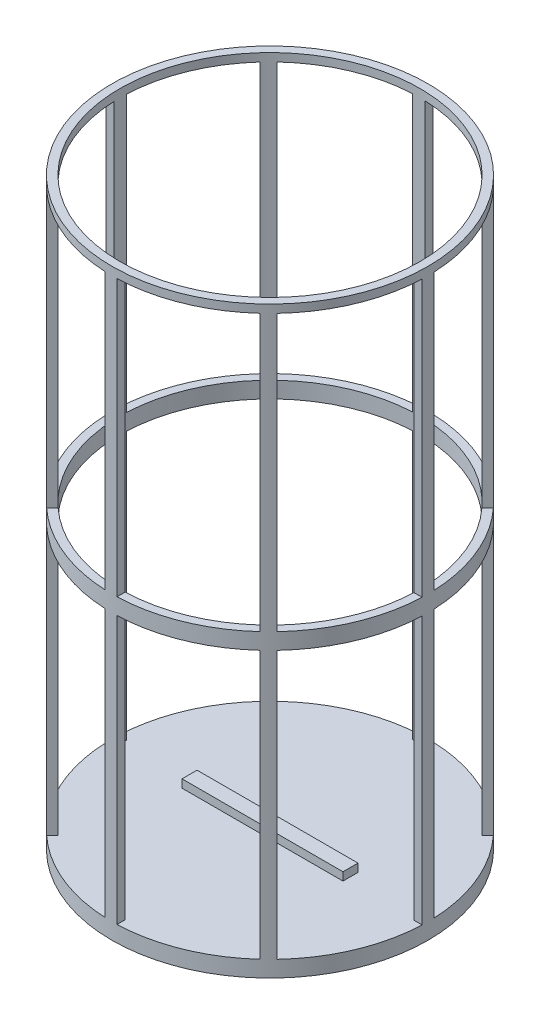
from build123d import *

# Parameters (mm, degrees)
SKETCH1_R               = 49.53
SKETCH1_R_2             = 46.99
BOSS_EXTRUDE1_DEPTH     = 182.88
CUT_EXTRUDE1_DEPTH      = 177.8
SKETCH3_R               = 49.53
SKETCH3_R_2             = 46.99
BOSS_EXTRUDE2_DEPTH     = 2.54
SKETCH4_R               = 49.53
SKETCH4_R_2             = 46.99
BOSS_EXTRUDE3_DEPTH     = 2.54
BOSS_EXTRUDE4_START     = -5.08
SKETCH5_R               = 49.53
BOSS_EXTRUDE4_DEPTH     = 5.08
SKETCH6_W               = 50.419
SKETCH6_H               = 4.699
BOSS_EXTRUDE5_DEPTH     = 2.54
SKETCH7_R               = 0.8255
BOSS_EXTRUDE6_DEPTH     = 2.54
CIRPATTERN2_COUNT       = 8
CUT_EXTRUDE2_DEPTH      = 199.209531052
CUT_EXTRUDE2_DEPTH_BACK = 199.209531052
SKETCH8_W               = 111.115562831
SKETCH8_H               = 193.581618433


with BuildPart() as part:
    # Sketch1 → Boss-Extrude1 (new, symmetric)
    with BuildSketch(Plane(origin=(0, 0, 0), x_dir=(1, 0, 0), z_dir=(0, 1, 0))):
        with Locations(Location((0, 0, 0), (0, 0, 270))):
            Circle(SKETCH1_R)
        with Locations(Location((0, 0, 0), (0, 0, 270))):
            Circle(SKETCH1_R_2, mode=Mode.SUBTRACT)
    extrude(amount=BOSS_EXTRUDE1_DEPTH, both=True)

    # Sketch2 → Cut-Extrude1 (cut, symmetric)
    with BuildSketch(Plane(origin=(0, 0, 0), x_dir=(1, 0, 0), z_dir=(0, 1, 0))):
        with BuildLine():
            Line((34.339077963, -32.07628134), (36.13611782, -33.873321197))
            ThreePointArc((36.13611782, -33.873321197), (45.710930003, -19.071753413), (49.49527883, -1.854258207))
            Line((49.49527883, -1.854258207), (46.953400585, -1.854258207))
            ThreePointArc((46.953400585, -1.854258207), (43.364264524, -18.099742051), (34.339077963, -32.07628134))
        make_face()
        with BuildLine():
            ThreePointArc((1.584890151, -49.504636381), (18.664975227, -45.878530924), (33.425440685, -36.550797734))
            Line((33.425440685, -36.550797734), (31.627502039, -34.752859088))
            ThreePointArc((31.627502039, -34.752859088), (17.692915235, -43.531837205), (1.584890151, -46.963264614))
            Line((1.584890151, -46.963264614), (1.584890151, -49.504636381))
        make_face()
        with BuildLine():
            ThreePointArc((-33.543952964, -36.442065248), (-19.03558139, -45.726005086), (-2.225109849, -49.479993797))
            Line((-2.225109849, -49.479993797), (-2.225109849, -46.937287801))
            ThreePointArc((-2.225109849, -46.937287801), (-18.063572268, -43.379343666), (-31.746279167, -34.644391451))
            Line((-31.746279167, -34.644391451), (-33.543952964, -36.442065248))
        make_face()
        with BuildLine():
            Line((46.949282998, 1.955741793), (49.491372723, 1.955741793))
            ThreePointArc((49.491372723, 1.955741793), (45.777644234, 18.911059948), (36.442065248, 33.543952964))
            Line((36.442065248, 33.543952964), (34.644391451, 31.746279167))
            ThreePointArc((34.644391451, 31.746279167), (43.430990742, 17.93903964), (46.949282998, 1.955741793))
        make_face()
        with BuildLine():
            ThreePointArc((-49.49527883, -1.854258207), (-45.741824116, -18.997537381), (-36.245883162, -33.755841773))
            Line((-36.245883162, -33.755841773), (-34.448634556, -31.958593167))
            ThreePointArc((-34.448634556, -31.958593167), (-43.39516767, -18.025524205), (-46.953400585, -1.854258207))
            Line((-46.953400585, -1.854258207), (-49.49527883, -1.854258207))
        make_face()
        with BuildLine():
            Line((31.958593167, 34.448634556), (33.755841773, 36.245883162))
            ThreePointArc((33.755841773, 36.245883162), (18.873008967, 45.79334485), (1.584890151, 49.504636381))
            Line((1.584890151, 49.504636381), (1.584890151, 46.963264614))
            ThreePointArc((1.584890151, 46.963264614), (17.900986276, 43.446689061), (31.958593167, 34.448634556))
        make_face()
        with BuildLine():
            ThreePointArc((-36.550797734, 33.425440685), (-45.80828813, 18.836709868), (-49.491372723, 1.955741793))
            Line((-49.491372723, 1.955741793), (-46.949282998, 1.955741793))
            ThreePointArc((-46.949282998, 1.955741793), (-43.461630715, 17.864678995), (-34.752859088, 31.627502039))
            Line((-34.752859088, 31.627502039), (-36.550797734, 33.425440685))
        make_face()
        with BuildLine():
            Line((-2.225109849, 46.937287801), (-2.225109849, 49.479993797))
            ThreePointArc((-2.225109849, 49.479993797), (-19.242893169, 45.63914945), (-33.873321197, 36.13611782))
            Line((-33.873321197, 36.13611782), (-32.07628134, 34.339077963))
            ThreePointArc((-32.07628134, 34.339077963), (-18.270880717, 43.292436035), (-2.225109849, 46.937287801))
        make_face()
    extrude(amount=CUT_EXTRUDE1_DEPTH, both=True, mode=Mode.SUBTRACT)

    # Sketch3 → Boss-Extrude2 (add, symmetric)
    with BuildSketch(Plane(origin=(0, 91.44, 0), x_dir=(1, 0, 0), z_dir=(0, 1, 0))):
        with Locations(Location((0, 0, 0), (0, 0, 270))):
            Circle(SKETCH3_R)
        with Locations(Location((0, 0, 0), (0, 0, 270))):
            Circle(SKETCH3_R_2, mode=Mode.SUBTRACT)
    boss_extrude2 = extrude(amount=BOSS_EXTRUDE2_DEPTH, both=True)

    # Mirror1: Boss-Extrude2 across plane
    add(boss_extrude2.mirror(Plane.ZX))

    # Sketch4 → Boss-Extrude3 (add, symmetric)
    with BuildSketch(Plane(origin=(0, 0, 0), x_dir=(1, 0, 0), z_dir=(0, 1, 0))):
        with Locations(Location((0, 0, 0), (0, 0, 270))):
            Circle(SKETCH4_R)
        with Locations(Location((0, 0, 0), (0, 0, 270))):
            Circle(SKETCH4_R_2, mode=Mode.SUBTRACT)
    extrude(amount=BOSS_EXTRUDE3_DEPTH, both=True)

    # Sketch5 → Boss-Extrude4 (add)
    with BuildSketch(Plane.XZ.offset(182.88).offset(BOSS_EXTRUDE4_START)):
        with Locations(Location((0, 0, 0), (0, 0, 90))):
            Circle(SKETCH5_R)
    extrude(amount=BOSS_EXTRUDE4_DEPTH)

    # Sketch6 → Boss-Extrude5 (add)
    with BuildSketch(Plane(origin=(0, -177.8, 0), x_dir=(1, 0, 0), z_dir=(0, 1, 0))):
        Rectangle(SKETCH6_W, SKETCH6_H)
    extrude(amount=BOSS_EXTRUDE5_DEPTH)

    # Sketch7 → Boss-Extrude6 (add)
    with BuildSketch(Plane(origin=(0, 182.88, 0), x_dir=(1, 0, 0), z_dir=(0, 1, 0))):
        with Locations(Location((48.26, 0, 0), (0, 0, 270))):
            Circle(SKETCH7_R)
    boss_extrude6 = extrude(amount=BOSS_EXTRUDE6_DEPTH)

    # CirPattern2: Boss-Extrude6 ×8 about axis
    cirpattern2_axis = Axis((0, 0, 0), (0, 1, 0))
    for i in range(1, CIRPATTERN2_COUNT):
        add(boss_extrude6.rotate(cirpattern2_axis, i * 360 / CIRPATTERN2_COUNT))

    # Sketch8 → Cut-Extrude2 (cut, two sides: drawn at the far end of the back side and taken through both)
    with BuildSketch(Plane.XY.offset(-CUT_EXTRUDE2_DEPTH_BACK)):
        with Locations((1.84635432, 96.790809217)):
            Rectangle(SKETCH8_W, SKETCH8_H)
    extrude(amount=CUT_EXTRUDE2_DEPTH + CUT_EXTRUDE2_DEPTH_BACK, mode=Mode.SUBTRACT)


solid = part.part
